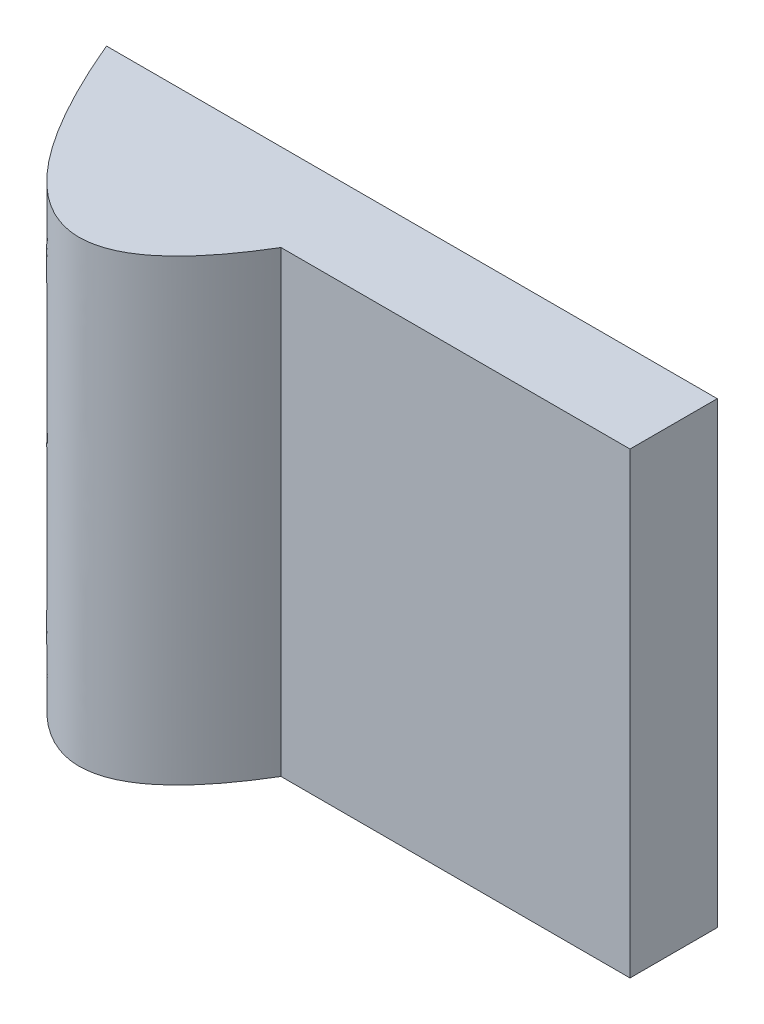
from build123d import *

# Parameters (mm, degrees)
SALIENTE_EXTRUIR1_DEPTH = 105
CORTAR_EXTRUIR2_START   = -2.5
CORTAR_EXTRUIR2_DEPTH   = 234.984671966


with BuildPart() as part:
    # Croquis2 → Saliente-Extruir1 (new body)
    with BuildSketch(Plane(origin=(0, 0, 0), x_dir=(1, 0, 0), z_dir=(0, 1, 0))):
        with BuildLine():
            Line((120, 70), (60, 70))
            add(Edge.make_bspline(
                [(60, 70), (89.76394683, -0.562785514), (120, 50)],
                knots=[0, 0, 0, 1, 1, 1], degree=2))
            Line((120, 50), (200, 50))
            Line((200, 50), (200, 70))
            Line((200, 70), (120, 70))
        make_face()
    extrude(amount=SALIENTE_EXTRUIR1_DEPTH)

    # Croquis4 → Cortar-Extruir2 (cut, through all)
    with BuildSketch(Plane(origin=(0, 105, 0), x_dir=(1, 0, 0), z_dir=(0, 1, 0)).offset(CORTAR_EXTRUIR2_START)):
        with BuildLine():
            Line((197.5, 67.5), (63.800779649, 67.5))
            add(Edge.make_bspline(
                [(63.800779649, 67.5), (65.18783691, 64.356396301), (66.644103156, 61.253475495), (69.752132806, 55.162552342), (71.402228827, 52.173569863), (74.104640396, 47.823690083), (75.043800331, 46.396276886), (77.024901029, 43.601867812), (78.066336024, 42.234574631), (79.738902554, 40.248539184), (80.316176798, 39.596382507), (81.504384845, 38.332520032), (82.11635398, 37.719397568), (83.384216047, 36.539396559), (84.04003863, 35.972443948), (85.407527446, 34.897332122), (86.114894929, 34.392932493), (87.573600332, 33.476694566), (88.326730919, 33.06323511), (89.501825231, 32.528313039), (89.901127997, 32.364288721), (90.717167486, 32.068984459), (91.136369007, 31.937111718), (92.403530819, 31.603509814), (93.258287044, 31.463528395), (94.556784576, 31.38866897), (94.992343306, 31.386226518), (95.869119285, 31.428064625), (96.30369887, 31.472081043), (97.591411513, 31.668142007), (98.431031327, 31.884173903), (99.666193937, 32.318036143), (100.074177189, 32.481317006), (100.869237422, 32.83523612), (101.258207725, 33.026473629), (102.402774127, 33.637457272), (103.136178711, 34.094219324), (104.201442555, 34.837481327), (104.550679955, 35.094994167), (105.238639259, 35.627559919), (105.577699644, 35.90295294), (107.2354852, 37.307560104), (108.455990571, 38.526129809), (110.76276443, 41.083743665), (111.847843608, 42.423855195), (113.920848072, 45.191271588), (114.908562721, 46.619572225), (116.797531302, 49.523204728), (117.700689072, 51.001365908), (118.571731582, 52.5)],
                knots=[0, 0, 0, 0, 0.125, 0.125, 0.25, 0.25, 0.3125, 0.3125, 0.375, 0.375, 0.40625, 0.40625, 0.4375, 0.4375, 0.46875, 0.46875, 0.5, 0.5, 0.53125, 0.53125, 0.546875, 0.546875, 0.5625, 0.5625, 0.59375, 0.59375, 0.609375, 0.609375, 0.625, 0.625, 0.65625, 0.65625, 0.671875, 0.671875, 0.6875, 0.6875, 0.71875, 0.71875, 0.734375, 0.734375, 0.75, 0.75, 0.8125, 0.8125, 0.875, 0.875, 0.9375, 0.9375, 1, 1, 1, 1], degree=3))
            Line((118.571731582, 52.5), (197.5, 52.5))
            Line((197.5, 52.5), (197.5, 67.5))
        make_face()
    extrude(amount=-CORTAR_EXTRUIR2_DEPTH, mode=Mode.SUBTRACT)


solid = part.part
